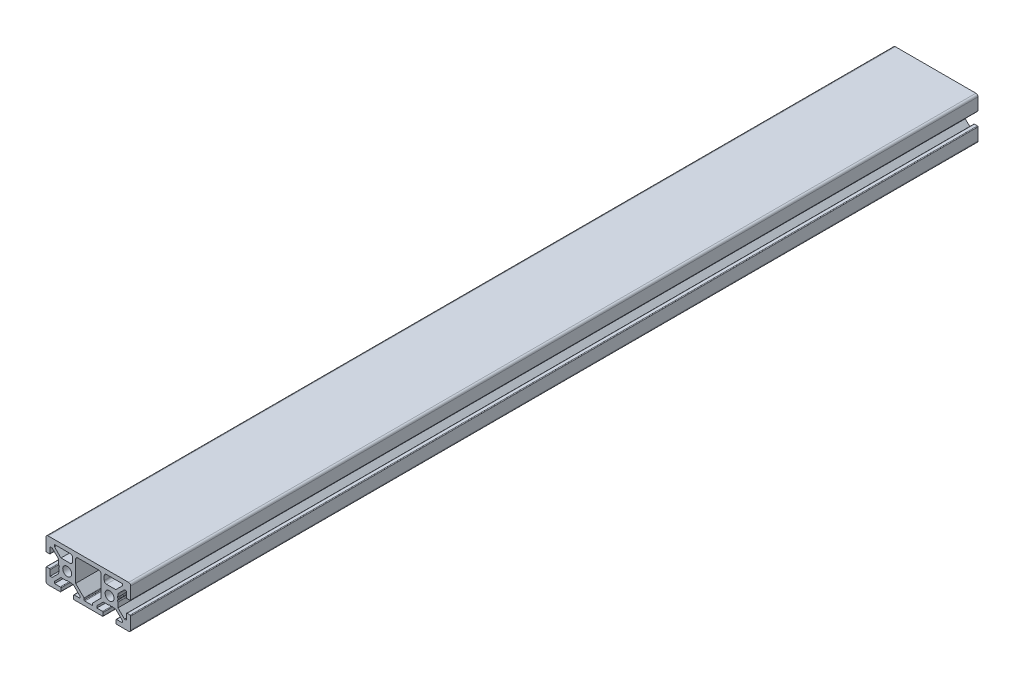
from build123d import *

# Parameters (mm, degrees)
MODEL_R             = 2.1
BOSS_EXTRUDE1_DEPTH = 400


with BuildPart() as part:
    # Model → Boss-Extrude1 (new body)
    with BuildSketch(Plane.XY):
        with BuildLine():
            Line((19, 10), (-19, 10))
            ThreePointArc((-19, 10), (-19.707106781, 9.707106781), (-20, 9))
            Line((-20, 9), (-20, 3.3))
            ThreePointArc((-20, 3.3), (-19.912132034, 3.087867966), (-19.7, 3))
            Line((-19.7, 3), (-18.3, 3))
            ThreePointArc((-18.3, 3), (-18.087867966, 3.087867966), (-18, 3.3))
            Line((-18, 3.3), (-18, 6))
            Line((-18, 6), (-17.060660172, 6))
            Line((-17.060660172, 6), (-14, 2.939339828))
            Line((-14, 2.939339828), (-14, 0.653589838))
            ThreePointArc((-14, 0.653589838), (-13.982962913, 0.524180316), (-13.933012702, 0.403589838))
            Line((-13.933012702, 0.403589838), (-13.7, 0))
            Line((-13.7, 0), (-13.933012702, -0.403589838))
            ThreePointArc((-13.933012702, -0.403589838), (-14, -0.653589838), (-13.933012702, -0.903589838))
            Line((-13.933012702, -0.903589838), (-13.750976592, -1.218885629))
            Line((-13.750976592, -1.218885629), (-14, -2.5))
            Line((-14, -2.5), (-14, -2.939339828))
            Line((-14, -2.939339828), (-17.060660172, -6))
            Line((-17.060660172, -6), (-18, -6))
            Line((-18, -6), (-18, -3.3))
            ThreePointArc((-18, -3.3), (-18.087867966, -3.087867966), (-18.3, -3))
            Line((-18.3, -3), (-19.7, -3))
            ThreePointArc((-19.7, -3), (-19.912132034, -3.087867966), (-20, -3.3))
            Line((-20, -3.3), (-20, -9))
            ThreePointArc((-20, -9), (-19.707106781, -9.707106781), (-19, -10))
            Line((-19, -10), (-13.3, -10))
            ThreePointArc((-13.3, -10), (-13.087867966, -9.912132034), (-13, -9.7))
            Line((-13, -9.7), (-13, -8.3))
            ThreePointArc((-13, -8.3), (-13.087867966, -8.087867966), (-13.3, -8))
            Line((-13.3, -8), (-16, -8))
            Line((-16, -8), (-16, -7.060660172))
            Line((-16, -7.060660172), (-12.939339828, -4))
            Line((-12.939339828, -4), (-10.653589838, -4))
            ThreePointArc((-10.653589838, -4), (-10.524180316, -3.982962913), (-10.403589838, -3.933012702))
            Line((-10.403589838, -3.933012702), (-10, -3.7))
            Line((-10, -3.7), (-9.596410162, -3.933012702))
            ThreePointArc((-9.596410162, -3.933012702), (-9.346410162, -4), (-9.096410162, -3.933012702))
            Line((-9.096410162, -3.933012702), (-8.781114371, -3.750976592))
            Line((-8.781114371, -3.750976592), (-7.5, -4))
            Line((-7.5, -4), (-7.060660172, -4))
            Line((-7.060660172, -4), (-4, -7.060660172))
            Line((-4, -7.060660172), (-4, -8))
            Line((-4, -8), (-6.7, -8))
            ThreePointArc((-6.7, -8), (-6.912132034, -8.087867966), (-7, -8.3))
            Line((-7, -8.3), (-7, -9.7))
            ThreePointArc((-7, -9.7), (-6.912132034, -9.912132034), (-6.7, -10))
            Line((-6.7, -10), (6.7, -10))
            ThreePointArc((6.7, -10), (6.912132034, -9.912132034), (7, -9.7))
            Line((7, -9.7), (7, -8.3))
            ThreePointArc((7, -8.3), (6.912132034, -8.087867966), (6.7, -8))
            Line((6.7, -8), (4, -8))
            Line((4, -8), (4, -7.060660172))
            Line((4, -7.060660172), (7.060660172, -4))
            Line((7.060660172, -4), (9.346410162, -4))
            ThreePointArc((9.346410162, -4), (9.475819684, -3.982962913), (9.596410162, -3.933012702))
            Line((9.596410162, -3.933012702), (10, -3.7))
            Line((10, -3.7), (10.403589838, -3.933012702))
            ThreePointArc((10.403589838, -3.933012702), (10.653589838, -4), (10.903589838, -3.933012702))
            Line((10.903589838, -3.933012702), (11.218885629, -3.750976592))
            Line((11.218885629, -3.750976592), (12.5, -4))
            Line((12.5, -4), (12.939339828, -4))
            Line((12.939339828, -4), (16, -7.060660172))
            Line((16, -7.060660172), (16, -8))
            Line((16, -8), (13.3, -8))
            ThreePointArc((13.3, -8), (13.087867966, -8.087867966), (13, -8.3))
            Line((13, -8.3), (13, -9.7))
            ThreePointArc((13, -9.7), (13.087867966, -9.912132034), (13.3, -10))
            Line((13.3, -10), (19, -10))
            ThreePointArc((19, -10), (19.707106781, -9.707106781), (20, -9))
            Line((20, -9), (20, -3.3))
            ThreePointArc((20, -3.3), (19.912132034, -3.087867966), (19.7, -3))
            Line((19.7, -3), (18.3, -3))
            ThreePointArc((18.3, -3), (18.087867966, -3.087867966), (18, -3.3))
            Line((18, -3.3), (18, -6))
            Line((18, -6), (17.060660172, -6))
            Line((17.060660172, -6), (14, -2.939339828))
            Line((14, -2.939339828), (14, -0.653589838))
            ThreePointArc((14, -0.653589838), (13.982962913, -0.524180316), (13.933012702, -0.403589838))
            Line((13.933012702, -0.403589838), (13.7, 0))
            Line((13.7, 0), (13.933012702, 0.403589838))
            ThreePointArc((13.933012702, 0.403589838), (14, 0.653589838), (13.933012702, 0.903589838))
            Line((13.933012702, 0.903589838), (13.750976592, 1.218885629))
            Line((13.750976592, 1.218885629), (14, 2.5))
            Line((14, 2.5), (14, 2.939339828))
            Line((14, 2.939339828), (17.060660172, 6))
            Line((17.060660172, 6), (18, 6))
            Line((18, 6), (18, 3.3))
            ThreePointArc((18, 3.3), (18.087867966, 3.087867966), (18.3, 3))
            Line((18.3, 3), (19.7, 3))
            ThreePointArc((19.7, 3), (19.912132034, 3.087867966), (20, 3.3))
            Line((20, 3.3), (20, 9))
            ThreePointArc((20, 9), (19.707106781, 9.707106781), (19, 10))
        make_face()
        with Locations((-10, 0)):
            Circle(MODEL_R, mode=Mode.SUBTRACT)
        with Locations((10, 0)):
            Circle(MODEL_R, mode=Mode.SUBTRACT)
        with BuildLine():
            Line((-8.5, 4), (-12.939339828, 4))
            Line((-12.939339828, 4), (-16, 7.060660172))
            Line((-16, 7.060660172), (-16, 8))
            Line((-16, 8), (-8.5, 8))
            ThreePointArc((-8.5, 8), (-7.792893219, 7.707106781), (-7.5, 7))
            Line((-7.5, 7), (-7.5, 5))
            ThreePointArc((-7.5, 5), (-7.792893219, 4.292893219), (-8.5, 4))
        make_face(mode=Mode.SUBTRACT)
        with BuildLine():
            Line((8.5, 4), (12.939339828, 4))
            Line((12.939339828, 4), (16, 7.060660172))
            Line((16, 7.060660172), (16, 8))
            Line((16, 8), (8.5, 8))
            ThreePointArc((8.5, 8), (7.792893219, 7.707106781), (7.5, 7))
            Line((7.5, 7), (7.5, 5))
            ThreePointArc((7.5, 5), (7.792893219, 4.292893219), (8.5, 4))
        make_face(mode=Mode.SUBTRACT)
        with BuildLine():
            Line((-6, 7), (-6, -2.939339828))
            Line((-6, -2.939339828), (-2.087867966, -6.851471863))
            ThreePointArc((-2.087867966, -6.851471863), (-2.02283614, -6.948798867), (-2, -7.063603897))
            Line((-2, -7.063603897), (-2, -7.7))
            ThreePointArc((-2, -7.7), (-1.912132034, -7.912132034), (-1.7, -8))
            Line((-1.7, -8), (1.7, -8))
            ThreePointArc((1.7, -8), (1.912132034, -7.912132034), (2, -7.7))
            Line((2, -7.7), (2, -7.063603897))
            ThreePointArc((2, -7.063603897), (2.02283614, -6.948798867), (2.087867966, -6.851471863))
            Line((2.087867966, -6.851471863), (6, -2.939339828))
            Line((6, -2.939339828), (6, 7))
            ThreePointArc((6, 7), (5.707106781, 7.707106781), (5, 8))
            Line((5, 8), (-5, 8))
            ThreePointArc((-5, 8), (-5.707106781, 7.707106781), (-6, 7))
        make_face(mode=Mode.SUBTRACT)
    extrude(amount=BOSS_EXTRUDE1_DEPTH)


solid = part.part
